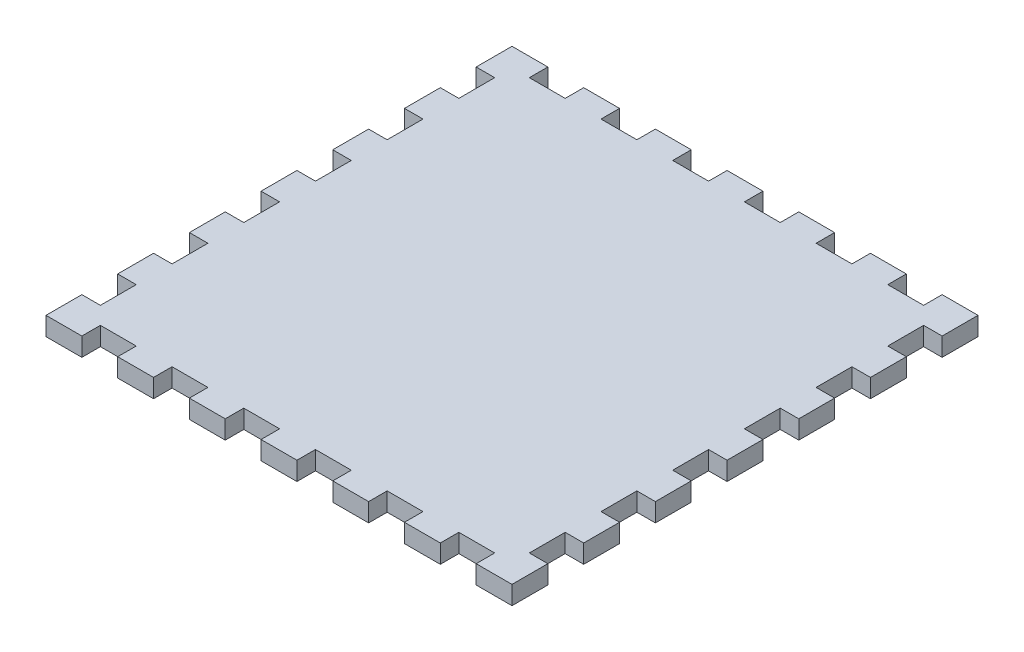
from build123d import *

# Parameters (mm, degrees)
SKETCH1_W           = 80
SKETCH1_H           = 80
BOSS_EXTRUDE1_DEPTH = 1.5875
SKETCH2_OUTSIDE_W   = 104.636
SKETCH2_OUTSIDE_H   = 104.636
CUT_EXTRUDE1_DEPTH  = 57.657573413


with BuildPart() as part:
    # Sketch1 → Boss-Extrude1 (new, symmetric)
    with BuildSketch(Plane(origin=(0, 0, 0), x_dir=(1, 0, 0), z_dir=(0, 1, 0))):
        Rectangle(SKETCH1_W, SKETCH1_H)
    extrude(amount=BOSS_EXTRUDE1_DEPTH, both=True)

    # Sketch2 outside → Cut-Extrude1 (cut, through all)
    with BuildSketch(Plane(origin=(0, 1.5875, 0), x_dir=(1, 0, 0), z_dir=(0, 1, 0))):
        Rectangle(SKETCH2_OUTSIDE_W, SKETCH2_OUTSIDE_H)
        Polygon((-40, 40), (-40, 33.846153846), (-36.82, 33.846153846), (-36.82, 27.692307692), (-40, 27.692307692), (-40, 21.538461538), (-36.82, 21.538461538), (-36.82, 15.384615385), (-40, 15.384615385), (-40, 9.230769231), (-36.82, 9.230769231), (-36.82, 3.076923077), (-40, 3.076923077), (-40, -3.076923077), (-36.82, -3.076923077), (-36.82, -9.230769231), (-40, -9.230769231), (-40, -15.384615385), (-36.82, -15.384615385), (-36.82, -21.538461538), (-40, -21.538461538), (-40, -27.692307692), (-36.82, -27.692307692), (-36.82, -33.846153846), (-40, -33.846153846), (-40, -40), (-33.846153846, -40), (-33.846153846, -36.82), (-27.692307692, -36.82), (-27.692307692, -40), (-21.538461538, -40), (-21.538461538, -36.82), (-15.384615385, -36.82), (-15.384615385, -40), (-9.230769231, -40), (-9.230769231, -36.82), (-3.076923077, -36.82), (-3.076923077, -40), (3.076923077, -40), (3.076923077, -36.82), (9.230769231, -36.82), (9.230769231, -40), (15.384615385, -40), (15.384615385, -36.82), (21.538461538, -36.82), (21.538461538, -40), (27.692307692, -40), (27.692307692, -36.82), (33.846153846, -36.82), (33.846153846, -40), (40, -40), (40, -33.846153846), (36.82, -33.846153846), (36.82, -27.692307692), (40, -27.692307692), (40, -21.538461538), (36.82, -21.538461538), (36.82, -15.384615385), (40, -15.384615385), (40, -9.230769231), (36.82, -9.230769231), (36.82, -3.076923077), (40, -3.076923077), (40, 3.076923077), (36.82, 3.076923077), (36.82, 9.230769231), (40, 9.230769231), (40, 15.384615385), (36.82, 15.384615385), (36.82, 21.538461538), (40, 21.538461538), (40, 27.692307692), (36.82, 27.692307692), (36.82, 33.846153846), (40, 33.846153846), (40, 40), (33.846153846, 40), (33.846153846, 36.82), (27.692307692, 36.82), (27.692307692, 40), (21.538461538, 40), (21.538461538, 36.82), (15.384615385, 36.82), (15.384615385, 40), (9.230769231, 40), (9.230769231, 36.82), (3.076923077, 36.82), (3.076923077, 40), (-3.076923077, 40), (-3.076923077, 36.82), (-9.230769231, 36.82), (-9.230769231, 40), (-15.384615385, 40), (-15.384615385, 36.82), (-21.538461538, 36.82), (-21.538461538, 40), (-27.692307692, 40), (-27.692307692, 36.82), (-33.846153846, 36.82), (-33.846153846, 40), align=None, mode=Mode.SUBTRACT)
    extrude(amount=-CUT_EXTRUDE1_DEPTH, mode=Mode.SUBTRACT)


solid = part.part
